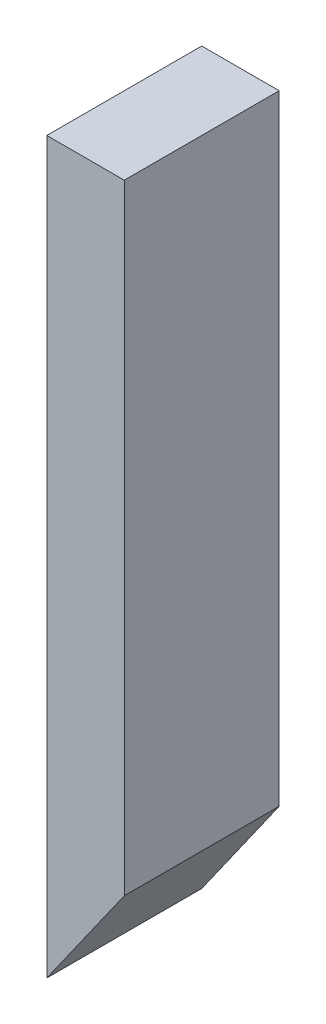
from build123d import *

# Parameters (mm, degrees)
BOSS_EXTRUDE1_DEPTH = 10


with BuildPart() as part:
    # Sketch1 → Boss-Extrude1 (new body)
    with BuildSketch(Plane.XY):
        Polygon((-11.944444444, -26.388888889), (-11.944444444, -33.484936515), (-6.944444444, -26.388888889), (-6.944444444, 13.611111111), (-11.944444444, 13.611111111), align=None)
    extrude(amount=BOSS_EXTRUDE1_DEPTH)


solid = part.part
